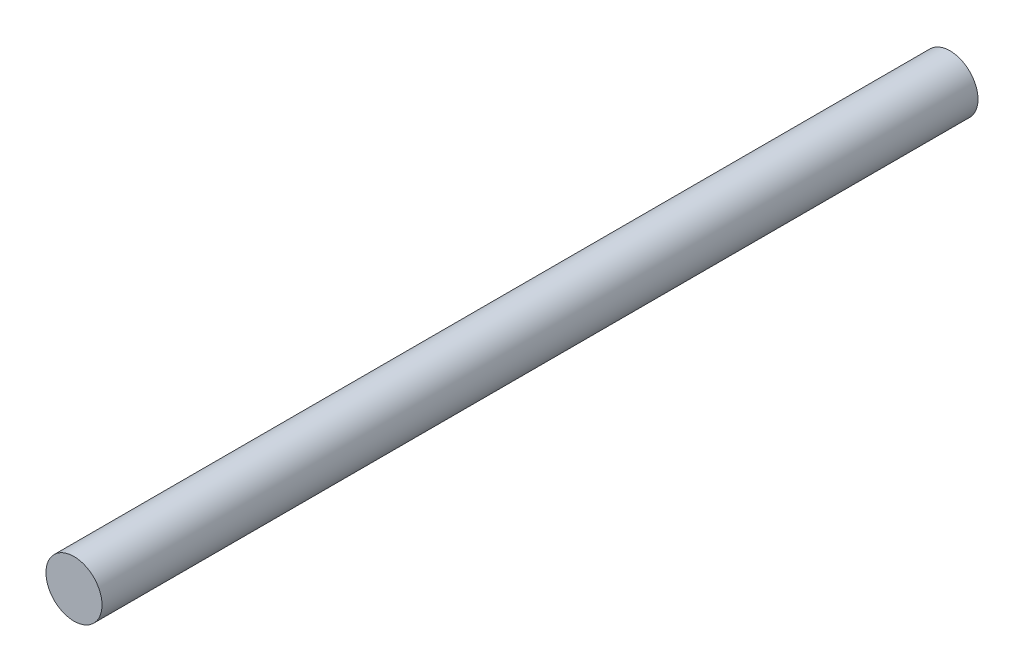
from build123d import *

# Parameters (mm, degrees)
SKETCH1_R           = 1.6
BOSS_EXTRUDE1_DEPTH = 50


with BuildPart() as part:
    # Sketch1 → Boss-Extrude1 (new body)
    with BuildSketch(Plane.XY):
        Circle(SKETCH1_R)
    extrude(amount=BOSS_EXTRUDE1_DEPTH)


solid = part.part
